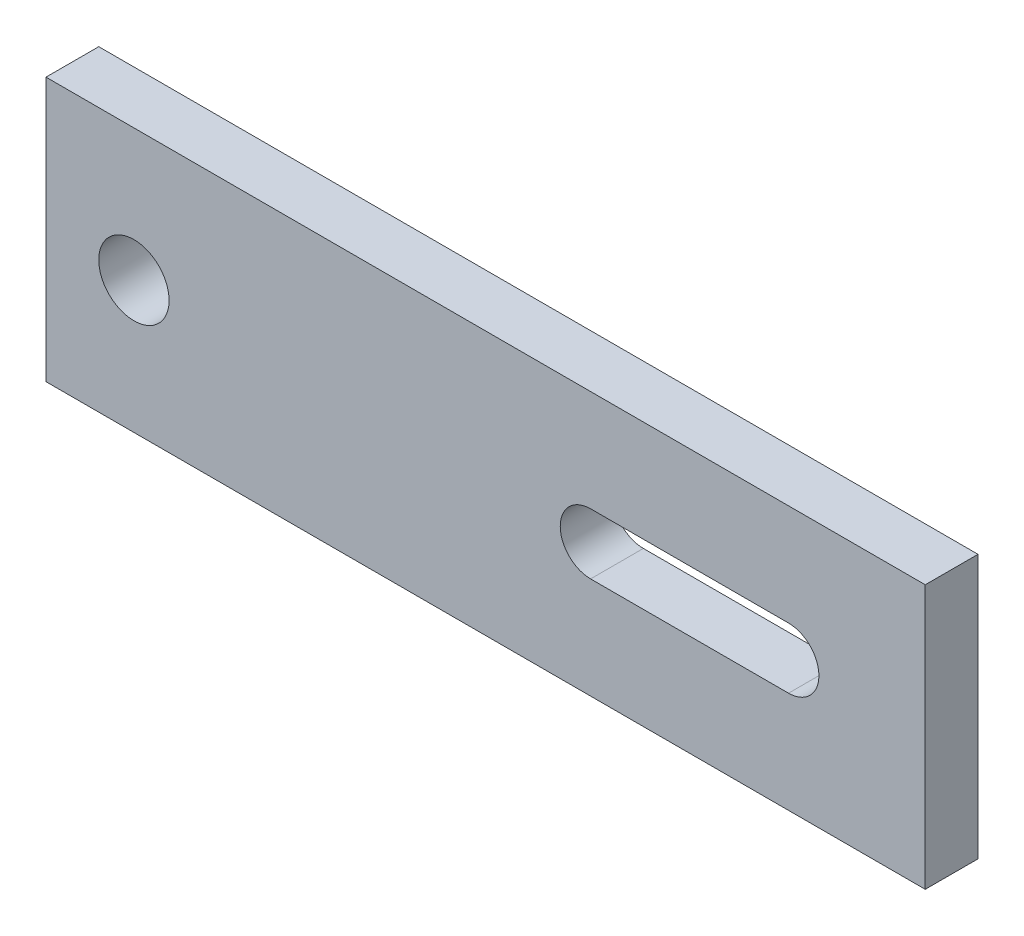
from build123d import *

# Parameters (mm, degrees)
SKETCH1_W           = 50
SKETCH1_H           = 15
BOSS_EXTRUDE1_DEPTH = 3
SKETCH2_R           = 2
CUT_EXTRUDE1_DEPTH  = 3
CUT_EXTRUDE2_DEPTH  = 3


with BuildPart() as part:
    # Sketch1 → Boss-Extrude1 (new body)
    with BuildSketch(Plane.XY):
        Rectangle(SKETCH1_W, SKETCH1_H)
    extrude(amount=BOSS_EXTRUDE1_DEPTH)

    # Sketch2 → Cut-Extrude1 (cut)
    with BuildSketch(Plane.XY.offset(3)):
        with Locations((-20, 0)):
            Circle(SKETCH2_R)
    extrude(amount=-CUT_EXTRUDE1_DEPTH, mode=Mode.SUBTRACT)

    # Sketch3 → Cut-Extrude2 (cut)
    with BuildSketch(Plane.XY.offset(3)):
        with BuildLine():
            Line((5.969403334, 1.726719429), (17.226282515, 1.726719429))
            ThreePointArc((17.226282515, 1.726719429), (18.953001944, 0), (17.226282515, -1.726719429))
            Line((17.226282515, -1.726719429), (5.969403334, -1.726719429))
            ThreePointArc((5.969403334, -1.726719429), (4.242683906, 0), (5.969403334, 1.726719429))
        make_face()
    extrude(amount=-CUT_EXTRUDE2_DEPTH, mode=Mode.SUBTRACT)


solid = part.part
